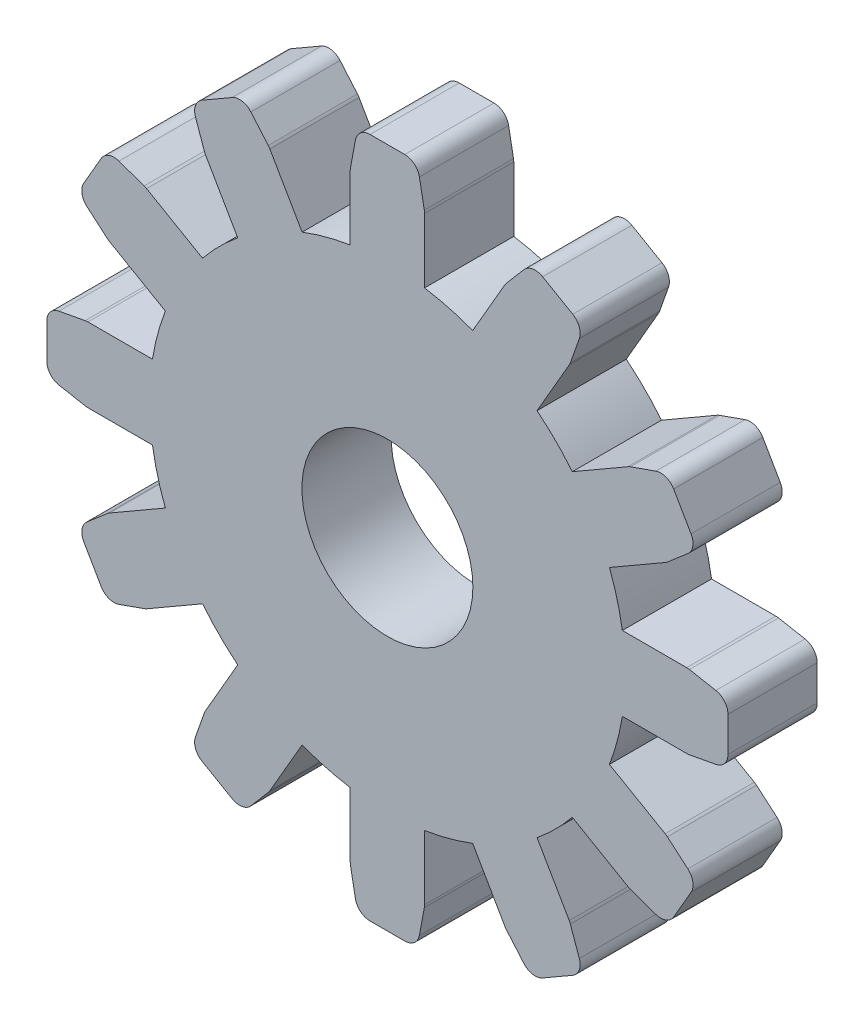
from build123d import *

# Parameters (mm, degrees)
SKETCH1_R           = 2.875
BOSS_EXTRUDE1_DEPTH = 3
FILLET1_R           = 0.5
FILLET2_R           = 0.5
FILLET3_R           = 0.5
FILLET4_R           = 0.5
FILLET5_R           = 0.5
FILLET6_R           = 0.5
FILLET7_R           = 0.5
FILLET8_R           = 0.5
FILLET9_R           = 0.5
FILLET10_R          = 0.5
FILLET11_R          = 0.5
FILLET12_R          = 0.5
FILLET13_R          = 0.5
FILLET14_R          = 0.5
FILLET15_R          = 0.5
FILLET16_R          = 0.5
FILLET17_R          = 0.5
FILLET18_R          = 0.5
FILLET19_R          = 0.5
FILLET20_R          = 0.5
FILLET21_R          = 0.5
FILLET22_R          = 0.5
FILLET23_R          = 0.5
FILLET24_R          = 0.5
FILLET25_R          = 0.5
FILLET26_R          = 0.5
FILLET27_R          = 0.5
FILLET28_R          = 0.5
FILLET29_R          = 0.5
FILLET30_R          = 0.5
FILLET31_R          = 0.5
FILLET32_R          = 0.5
FILLET33_R          = 0.5
FILLET34_R          = 0.5
FILLET35_R          = 0.5
FILLET36_R          = 0.5
FILLET41_R          = 0.5
FILLET42_R          = 0.5
FILLET43_R          = 0.5
FILLET44_R          = 0.5
FILLET45_R          = 0.5
FILLET46_R          = 0.5
FILLET47_R          = 0.5
FILLET48_R          = 0.5


with BuildPart() as part:
    # Sketch1 → Boss-Extrude1 (new body)
    with BuildSketch(Plane.XY):
        with BuildLine():
            Line((-1, 11.454813213), (1, 11.454813213))
            Line((1, 11.454813213), (1.25, 10.118734291))
            Line((1.25, 10.118734291), (1.25, 7.901740315))
            ThreePointArc((1.25, 7.901740315), (2.070552361, 7.72740661), (2.868338403, 7.468107847))
            Line((2.868338403, 7.468107847), (3.972583989, 9.380717307))
            Line((3.972583989, 9.380717307), (4.861381203, 10.420159238))
            Line((4.861381203, 10.420159238), (6.59343201, 9.420159238))
            Line((6.59343201, 9.420159238), (6.1418989, 8.13808095))
            Line((6.1418989, 8.13808095), (5.033401912, 6.218107847))
            ThreePointArc((5.033401912, 6.218107847), (5.656854249, 5.656854249), (6.218107847, 5.033401912))
            Line((6.218107847, 5.033401912), (8.130717307, 6.137647499))
            Line((8.130717307, 6.137647499), (9.420159238, 6.59343201))
            Line((9.420159238, 6.59343201), (10.420159238, 4.861381203))
            Line((10.420159238, 4.861381203), (9.38808095, 3.976835391))
            Line((9.38808095, 3.976835391), (7.468107847, 2.868338403))
            ThreePointArc((7.468107847, 2.868338403), (7.72740661, 2.070552361), (7.901740315, 1.25))
            Line((7.901740315, 1.25), (10.110231488, 1.25))
            Line((10.110231488, 1.25), (11.454813213, 1))
            Line((11.454813213, 1), (11.454813213, -1))
            Line((11.454813213, -1), (10.118734291, -1.25))
            Line((10.118734291, -1.25), (7.901740315, -1.25))
            ThreePointArc((7.901740315, -1.25), (7.72740661, -2.070552361), (7.468107847, -2.868338403))
            Line((7.468107847, -2.868338403), (9.380717307, -3.972583989))
            Line((9.380717307, -3.972583989), (10.420159238, -4.861381203))
            Line((10.420159238, -4.861381203), (9.420159238, -6.59343201))
            Line((9.420159238, -6.59343201), (8.13808095, -6.1418989))
            Line((8.13808095, -6.1418989), (6.218107847, -5.033401912))
            ThreePointArc((6.218107847, -5.033401912), (5.656854249, -5.656854249), (5.033401912, -6.218107847))
            Line((5.033401912, -6.218107847), (6.137647499, -8.130717307))
            Line((6.137647499, -8.130717307), (6.59343201, -9.420159238))
            Line((6.59343201, -9.420159238), (4.861381203, -10.420159238))
            Line((4.861381203, -10.420159238), (3.976835391, -9.38808095))
            Line((3.976835391, -9.38808095), (2.868338403, -7.468107847))
            ThreePointArc((2.868338403, -7.468107847), (2.070552361, -7.72740661), (1.25, -7.901740315))
            Line((1.25, -7.901740315), (1.25, -10.110231488))
            Line((1.25, -10.110231488), (1, -11.454813213))
            Line((1, -11.454813213), (-1, -11.454813213))
            Line((-1, -11.454813213), (-1.25, -10.118734291))
            Line((-1.25, -10.118734291), (-1.25, -7.901740315))
            ThreePointArc((-1.25, -7.901740315), (-2.070552361, -7.72740661), (-2.868338403, -7.468107847))
            Line((-2.868338403, -7.468107847), (-3.972583989, -9.380717307))
            Line((-3.972583989, -9.380717307), (-4.861381203, -10.420159238))
            Line((-4.861381203, -10.420159238), (-6.59343201, -9.420159238))
            Line((-6.59343201, -9.420159238), (-6.1418989, -8.13808095))
            Line((-6.1418989, -8.13808095), (-5.033401912, -6.218107847))
            ThreePointArc((-5.033401912, -6.218107847), (-5.656854249, -5.656854249), (-6.218107847, -5.033401912))
            Line((-6.218107847, -5.033401912), (-8.130717307, -6.137647499))
            Line((-8.130717307, -6.137647499), (-9.420159238, -6.59343201))
            Line((-9.420159238, -6.59343201), (-10.420159238, -4.861381203))
            Line((-10.420159238, -4.861381203), (-9.38808095, -3.976835391))
            Line((-9.38808095, -3.976835391), (-7.468107847, -2.868338403))
            ThreePointArc((-7.468107847, -2.868338403), (-7.72740661, -2.070552361), (-7.901740315, -1.25))
            Line((-7.901740315, -1.25), (-10.110231488, -1.25))
            Line((-10.110231488, -1.25), (-11.454813213, -1))
            Line((-11.454813213, -1), (-11.454813213, 1))
            Line((-11.454813213, 1), (-10.118734291, 1.25))
            Line((-10.118734291, 1.25), (-7.901740315, 1.25))
            ThreePointArc((-7.901740315, 1.25), (-7.72740661, 2.070552361), (-7.468107847, 2.868338403))
            Line((-7.468107847, 2.868338403), (-9.380717307, 3.972583989))
            Line((-9.380717307, 3.972583989), (-10.420159238, 4.861381203))
            Line((-10.420159238, 4.861381203), (-9.420159238, 6.59343201))
            Line((-9.420159238, 6.59343201), (-8.13808095, 6.1418989))
            Line((-8.13808095, 6.1418989), (-6.218107847, 5.033401912))
            ThreePointArc((-6.218107847, 5.033401912), (-5.656854249, 5.656854249), (-5.033401912, 6.218107847))
            Line((-5.033401912, 6.218107847), (-6.137647499, 8.130717307))
            Line((-6.137647499, 8.130717307), (-6.59343201, 9.420159238))
            Line((-6.59343201, 9.420159238), (-4.861381203, 10.420159238))
            Line((-4.861381203, 10.420159238), (-3.976835391, 9.38808095))
            Line((-3.976835391, 9.38808095), (-2.868338403, 7.468107847))
            ThreePointArc((-2.868338403, 7.468107847), (-2.070552361, 7.72740661), (-1.25, 7.901740315))
            Line((-1.25, 7.901740315), (-1.25, 10.110231488))
            Line((-1.25, 10.110231488), (-1, 11.454813213))
        make_face()
        Circle(SKETCH1_R, mode=Mode.SUBTRACT)
    extrude(amount=BOSS_EXTRUDE1_DEPTH)

    # Fillet1
    fillet1_edges = [part.edges().sort_by_distance(p)[0] for p in [
        (1, 11.454813213, 1.5),
    ]]
    fillet(fillet1_edges, radius=FILLET1_R)

    # Fillet2
    fillet2_edges = [part.edges().sort_by_distance(p)[0] for p in [
        (-1, 11.454813213, 1.5),
    ]]
    fillet(fillet2_edges, radius=FILLET2_R)

    # Fillet3
    fillet3_edges = [part.edges().sort_by_distance(p)[0] for p in [
        (6.59343201, 9.420159238, 1.5),
    ]]
    fillet(fillet3_edges, radius=FILLET3_R)

    # Fillet4
    fillet4_edges = [part.edges().sort_by_distance(p)[0] for p in [
        (4.861381203, 10.420159238, 1.5),
    ]]
    fillet(fillet4_edges, radius=FILLET4_R)

    # Fillet5
    fillet5_edges = [part.edges().sort_by_distance(p)[0] for p in [
        (9.420159238, 6.59343201, 1.5),
    ]]
    fillet(fillet5_edges, radius=FILLET5_R)

    # Fillet6
    fillet6_edges = [part.edges().sort_by_distance(p)[0] for p in [
        (10.420159238, 4.861381203, 1.5),
    ]]
    fillet(fillet6_edges, radius=FILLET6_R)

    # Fillet7
    fillet7_edges = [part.edges().sort_by_distance(p)[0] for p in [
        (11.454813213, 1, 1.5),
    ]]
    fillet(fillet7_edges, radius=FILLET7_R)

    # Fillet8
    fillet8_edges = [part.edges().sort_by_distance(p)[0] for p in [
        (11.454813213, -1, 1.5),
    ]]
    fillet(fillet8_edges, radius=FILLET8_R)

    # Fillet9
    fillet9_edges = [part.edges().sort_by_distance(p)[0] for p in [
        (10.420159238, -4.861381203, 1.5),
    ]]
    fillet(fillet9_edges, radius=FILLET9_R)

    # Fillet10
    fillet10_edges = [part.edges().sort_by_distance(p)[0] for p in [
        (9.420159238, -6.59343201, 1.5),
    ]]
    fillet(fillet10_edges, radius=FILLET10_R)

    # Fillet11
    fillet11_edges = [part.edges().sort_by_distance(p)[0] for p in [
        (6.59343201, -9.420159238, 1.5),
    ]]
    fillet(fillet11_edges, radius=FILLET11_R)

    # Fillet12
    fillet12_edges = [part.edges().sort_by_distance(p)[0] for p in [
        (4.861381203, -10.420159238, 1.5),
    ]]
    fillet(fillet12_edges, radius=FILLET12_R)

    # Fillet13
    fillet13_edges = [part.edges().sort_by_distance(p)[0] for p in [
        (1, -11.454813213, 1.5),
    ]]
    fillet(fillet13_edges, radius=FILLET13_R)

    # Fillet14
    fillet14_edges = [part.edges().sort_by_distance(p)[0] for p in [
        (-1, -11.454813213, 1.5),
    ]]
    fillet(fillet14_edges, radius=FILLET14_R)

    # Fillet15
    fillet15_edges = [part.edges().sort_by_distance(p)[0] for p in [
        (-4.861381203, -10.420159238, 1.5),
    ]]
    fillet(fillet15_edges, radius=FILLET15_R)

    # Fillet16
    fillet16_edges = [part.edges().sort_by_distance(p)[0] for p in [
        (-6.59343201, -9.420159238, 1.5),
    ]]
    fillet(fillet16_edges, radius=FILLET16_R)

    # Fillet17
    fillet17_edges = [part.edges().sort_by_distance(p)[0] for p in [
        (-9.420159238, -6.59343201, 1.5),
    ]]
    fillet(fillet17_edges, radius=FILLET17_R)

    # Fillet18
    fillet18_edges = [part.edges().sort_by_distance(p)[0] for p in [
        (-11.454813213, 1, 1.5),
    ]]
    fillet(fillet18_edges, radius=FILLET18_R)

    # Fillet19
    fillet19_edges = [part.edges().sort_by_distance(p)[0] for p in [
        (-10.420159238, 4.861381203, 1.5),
    ]]
    fillet(fillet19_edges, radius=FILLET19_R)

    # Fillet20
    fillet20_edges = [part.edges().sort_by_distance(p)[0] for p in [
        (-4.861381203, 10.420159238, 1.5),
    ]]
    fillet(fillet20_edges, radius=FILLET20_R)

    # Fillet21
    fillet21_edges = [part.edges().sort_by_distance(p)[0] for p in [
        (-1.25, 10.110231488, 1.5),
    ]]
    fillet(fillet21_edges, radius=FILLET21_R)

    # Fillet22
    fillet22_edges = [part.edges().sort_by_distance(p)[0] for p in [
        (1.25, 10.118734291, 1.5),
    ]]
    fillet(fillet22_edges, radius=FILLET22_R)

    # Fillet23
    fillet23_edges = [part.edges().sort_by_distance(p)[0] for p in [
        (3.972583989, 9.380717307, 1.5),
    ]]
    fillet(fillet23_edges, radius=FILLET23_R)

    # Fillet24
    fillet24_edges = [part.edges().sort_by_distance(p)[0] for p in [
        (6.1418989, 8.13808095, 1.5),
    ]]
    fillet(fillet24_edges, radius=FILLET24_R)

    # Fillet25
    fillet25_edges = [part.edges().sort_by_distance(p)[0] for p in [
        (8.130717307, 6.137647499, 1.5),
    ]]
    fillet(fillet25_edges, radius=FILLET25_R)

    # Fillet26
    fillet26_edges = [part.edges().sort_by_distance(p)[0] for p in [
        (9.38808095, 3.976835391, 1.5),
    ]]
    fillet(fillet26_edges, radius=FILLET26_R)

    # Fillet27
    fillet27_edges = [part.edges().sort_by_distance(p)[0] for p in [
        (10.110231488, 1.25, 1.5),
    ]]
    fillet(fillet27_edges, radius=FILLET27_R)

    # Fillet28
    fillet28_edges = [part.edges().sort_by_distance(p)[0] for p in [
        (10.118734291, -1.25, 1.5),
    ]]
    fillet(fillet28_edges, radius=FILLET28_R)

    # Fillet29
    fillet29_edges = [part.edges().sort_by_distance(p)[0] for p in [
        (9.380717307, -3.972583989, 1.5),
    ]]
    fillet(fillet29_edges, radius=FILLET29_R)

    # Fillet30
    fillet30_edges = [part.edges().sort_by_distance(p)[0] for p in [
        (8.13808095, -6.1418989, 1.5),
    ]]
    fillet(fillet30_edges, radius=FILLET30_R)

    # Fillet31
    fillet31_edges = [part.edges().sort_by_distance(p)[0] for p in [
        (3.976835391, -9.38808095, 1.5),
    ]]
    fillet(fillet31_edges, radius=FILLET31_R)

    # Fillet32
    fillet32_edges = [part.edges().sort_by_distance(p)[0] for p in [
        (6.137647499, -8.130717307, 1.5),
    ]]
    fillet(fillet32_edges, radius=FILLET32_R)

    # Fillet33
    fillet33_edges = [part.edges().sort_by_distance(p)[0] for p in [
        (1.25, -10.110231488, 1.5),
    ]]
    fillet(fillet33_edges, radius=FILLET33_R)

    # Fillet34
    fillet34_edges = [part.edges().sort_by_distance(p)[0] for p in [
        (-1.25, -10.118734291, 1.5),
        (-3.972583989, -9.380717307, 1.5),
    ]]
    fillet(fillet34_edges, radius=FILLET34_R)

    # Fillet35
    fillet35_edges = [part.edges().sort_by_distance(p)[0] for p in [
        (-9.38808095, -3.976835391, 1.5),
    ]]
    fillet(fillet35_edges, radius=FILLET35_R)

    # Fillet36
    fillet36_edges = [part.edges().sort_by_distance(p)[0] for p in [
        (-8.130717307, -6.137647499, 1.5),
        (-11.454813213, -1, 1.5),
    ]]
    fillet(fillet36_edges, radius=FILLET36_R)

    # Fillet41
    fillet41_edges = [part.edges().sort_by_distance(p)[0] for p in [
        (-6.59343201, 9.420159238, 1.5),
    ]]
    fillet(fillet41_edges, radius=FILLET41_R)

    # Fillet42
    fillet42_edges = [part.edges().sort_by_distance(p)[0] for p in [
        (-6.137647499, 8.130717307, 1.5),
    ]]
    fillet(fillet42_edges, radius=FILLET42_R)

    # Fillet43
    fillet43_edges = [part.edges().sort_by_distance(p)[0] for p in [
        (-8.13808095, 6.1418989, 1.5),
    ]]
    fillet(fillet43_edges, radius=FILLET43_R)

    # Fillet44
    fillet44_edges = [part.edges().sort_by_distance(p)[0] for p in [
        (-9.420159238, 6.59343201, 1.5),
    ]]
    fillet(fillet44_edges, radius=FILLET44_R)

    # Fillet45
    fillet45_edges = [part.edges().sort_by_distance(p)[0] for p in [
        (-3.976835391, 9.38808095, 1.5),
    ]]
    fillet(fillet45_edges, radius=FILLET45_R)

    # Fillet46
    fillet46_edges = [part.edges().sort_by_distance(p)[0] for p in [
        (-10.420159238, -4.861381203, 1.5),
    ]]
    fillet(fillet46_edges, radius=FILLET46_R)

    # Fillet47
    fillet47_edges = [part.edges().sort_by_distance(p)[0] for p in [
        (-10.118734291, 1.25, 1.5),
    ]]
    fillet(fillet47_edges, radius=FILLET47_R)

    # Fillet48
    fillet48_edges = [part.edges().sort_by_distance(p)[0] for p in [
        (-10.110231488, -1.25, 1.5),
    ]]
    fillet(fillet48_edges, radius=FILLET48_R)


solid = part.part
